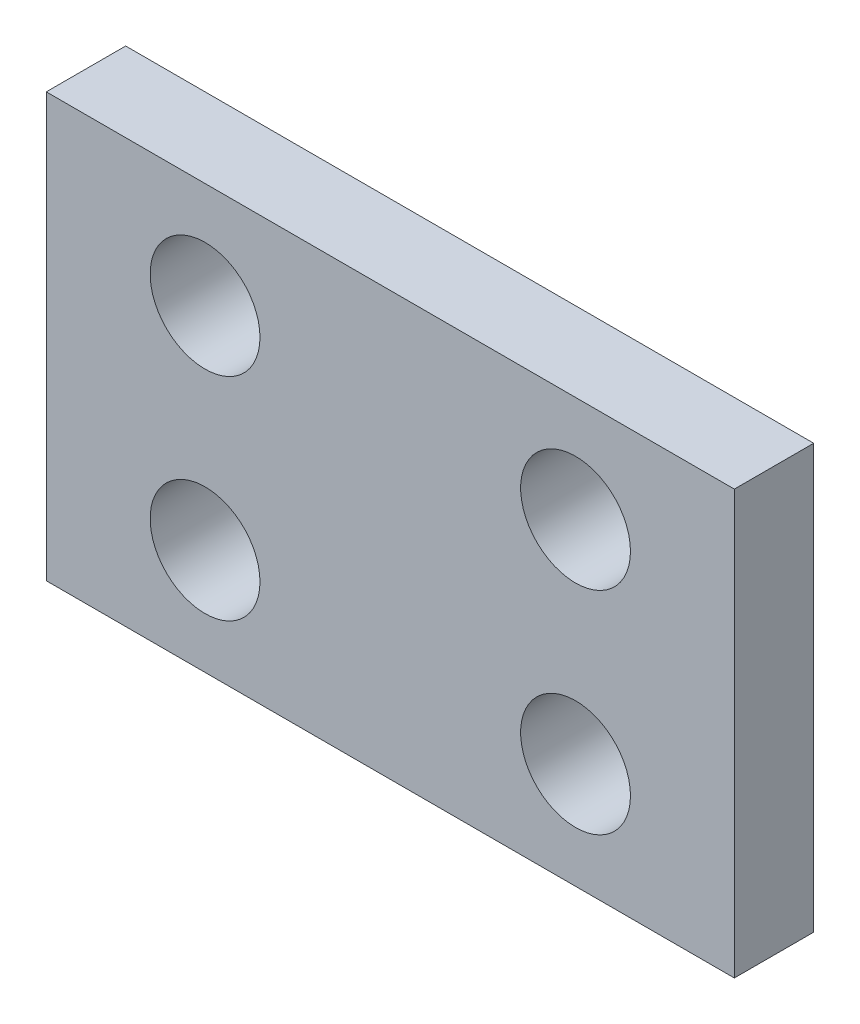
from build123d import *

# Parameters (mm, degrees)
SKETCH_1_W          = 26
SKETCH_1_H          = 16
EXTRUDE_1_DEPTH     = 3
SKETCH_2_R          = 2.075
CUT_EXTRUDE_1_DEPTH = 3


with BuildPart() as part:
    # 草图1 → 凸台-拉伸1 (new body)
    with BuildSketch(Plane.XY):
        with Locations((13, 8)):
            Rectangle(SKETCH_1_W, SKETCH_1_H)
    extrude(amount=EXTRUDE_1_DEPTH)

    # 草图2 → 切除-拉伸1 (cut)
    with BuildSketch(Plane.XY.offset(3)):
        with Locations((6, 12)):
            Circle(SKETCH_2_R)
        with Locations((20, 12)):
            Circle(SKETCH_2_R)
        with Locations((6, 4)):
            Circle(SKETCH_2_R)
        with Locations((20, 4)):
            Circle(SKETCH_2_R)
    extrude(amount=-CUT_EXTRUDE_1_DEPTH, mode=Mode.SUBTRACT)


solid = part.part
